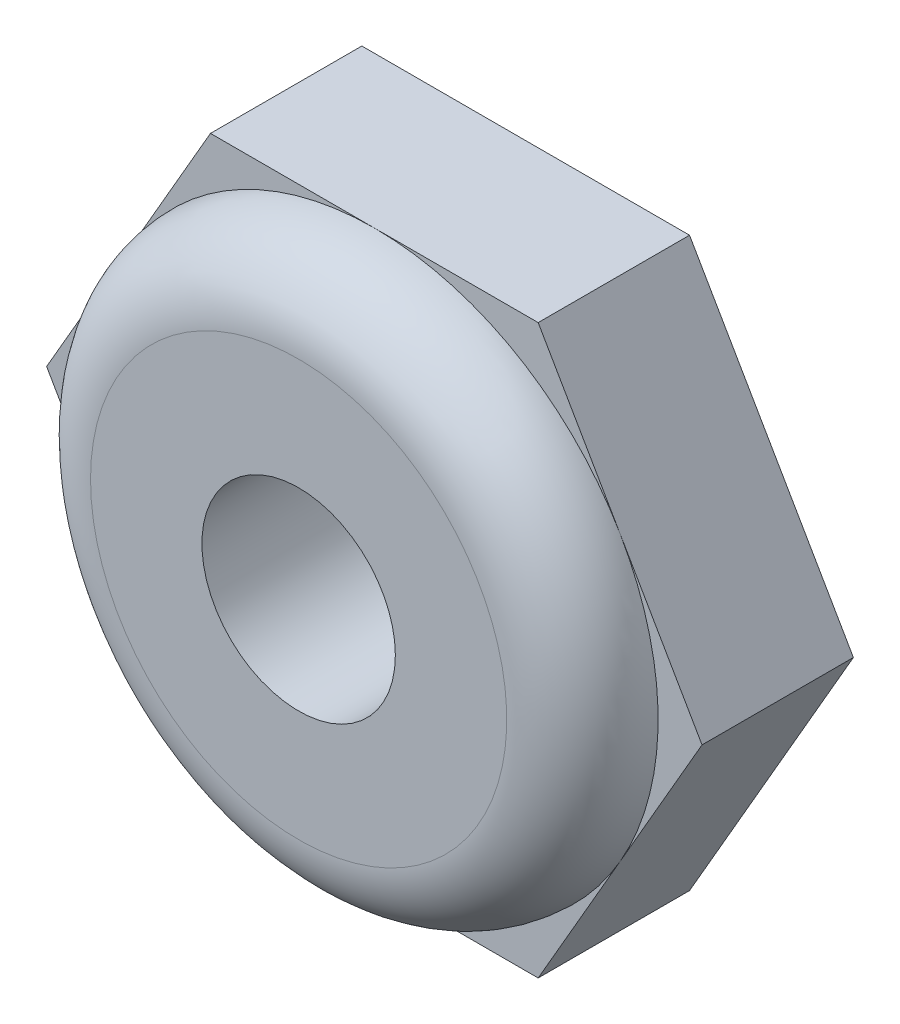
from build123d import *

# Parameters (mm, degrees)
SKETCH1_R           = 1.35255
BOSS_EXTRUDE1_DEPTH = 3.175


with BuildPart() as part:
    # Sketch1 → Boss-Extrude1 (new body)
    with BuildSketch(Plane.XY):
        Polygon((2.291358881, 3.96875), (-2.291358881, 3.96875), (-4.582717762, 0), (-2.291358881, -3.96875), (2.291358881, -3.96875), (4.582717762, 0), align=None)
        Circle(SKETCH1_R, mode=Mode.SUBTRACT)
    extrude(amount=BOSS_EXTRUDE1_DEPTH)

    # Sketch2 → Cut-Revolve2 (revolve, cut)
    with BuildSketch(Plane(origin=(0, 0, 0), x_dir=(0, 0, -1), z_dir=(1, 0, 0))):
        with BuildLine():
            Line((-3.175, 3.96875), (-3.175, 2.910416667))
            ThreePointArc((-3.175, 2.910416667), (-2.865021343, 3.658771343), (-2.116666667, 3.96875))
            Line((-2.116666667, 3.96875), (-2.116666667, 5.953125))
            Line((-2.116666667, 5.953125), (-3.175, 5.953125))
            Line((-3.175, 5.953125), (-3.175, 3.96875))
        make_face()
    revolve(axis=Axis((0, 0, -0.15875), (0, 0, 1)), mode=Mode.SUBTRACT)


solid = part.part
